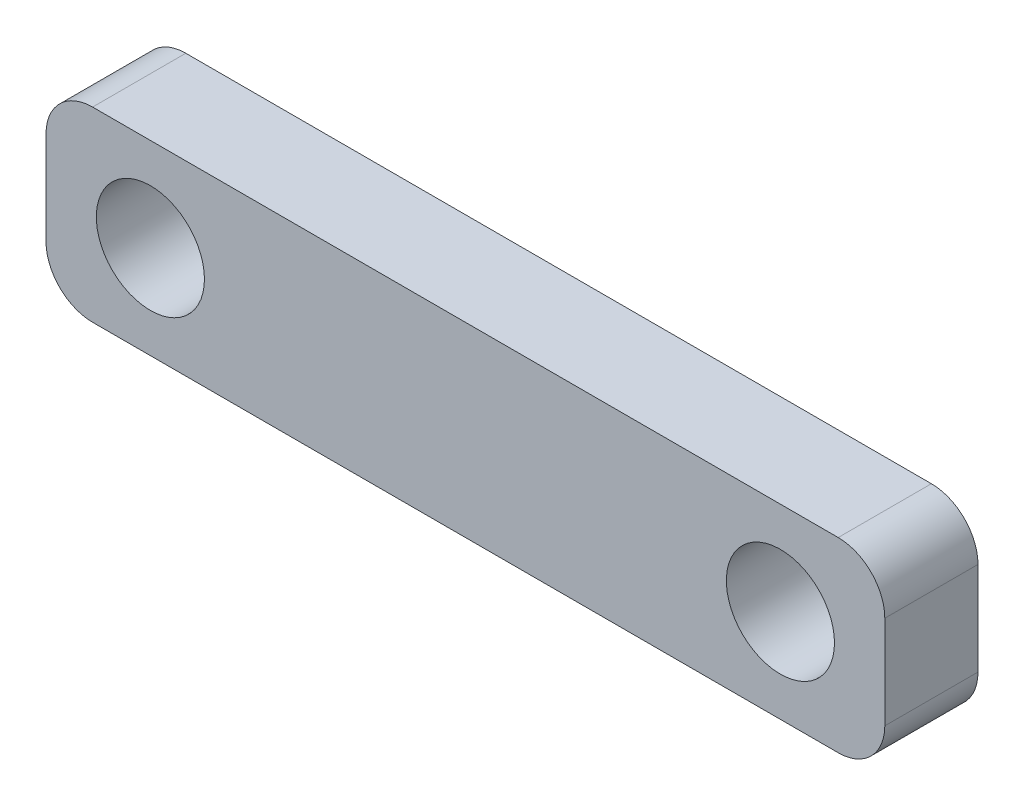
from build123d import *

# Parameters (mm, degrees)
SKETCH1_W           = 14.2875
SKETCH1_H           = 3.175
BOSS_EXTRUDE1_DEPTH = 1.5875
CUT_EXTRUDE1_REACH  = 9.488
SKETCH2_R           = 0.92075
FILLET1_R           = 0.79375


with BuildPart() as part:
    # Sketch1 → Boss-Extrude1 (new body)
    with BuildSketch(Plane.XY):
        Rectangle(SKETCH1_W, SKETCH1_H)
    extrude(amount=BOSS_EXTRUDE1_DEPTH)

    # Sketch2 → Cut-Extrude1 (cut, up to next)
    with BuildSketch(Plane.XY.offset(1.5875), mode=Mode.PRIVATE) as cut_extrude1_sk1:
        with Locations((-5.36575, 0)):
            Circle(SKETCH2_R)
    cut_extrude1_tool1 = extrude(cut_extrude1_sk1.sketch, amount=-CUT_EXTRUDE1_REACH, mode=Mode.PRIVATE) & part.part
    # Sketch2 → Cut-Extrude1 (cut, up to next)
    with BuildSketch(Plane.XY.offset(1.5875), mode=Mode.PRIVATE) as cut_extrude1_sk2:
        with Locations((5.36575, 0)):
            Circle(SKETCH2_R)
    cut_extrude1_tool2 = extrude(cut_extrude1_sk2.sketch, amount=-CUT_EXTRUDE1_REACH, mode=Mode.PRIVATE) & part.part
    add(cut_extrude1_tool1.solids().sort_by_distance((-5.36575, 0, 1.5875))[0], mode=Mode.SUBTRACT)
    add(cut_extrude1_tool2.solids().sort_by_distance((5.36575, 0, 1.5875))[0], mode=Mode.SUBTRACT)

    # Fillet1
    fillet1_edges = [part.edges().sort_by_distance(p)[0] for p in [
        (7.14375, -1.5875, 0.79375),
        (-7.14375, -1.5875, 0.79375),
        (-7.14375, 1.5875, 0.79375),
        (7.14375, 1.5875, 0.79375),
    ]]
    fillet(fillet1_edges, radius=FILLET1_R)


solid = part.part
